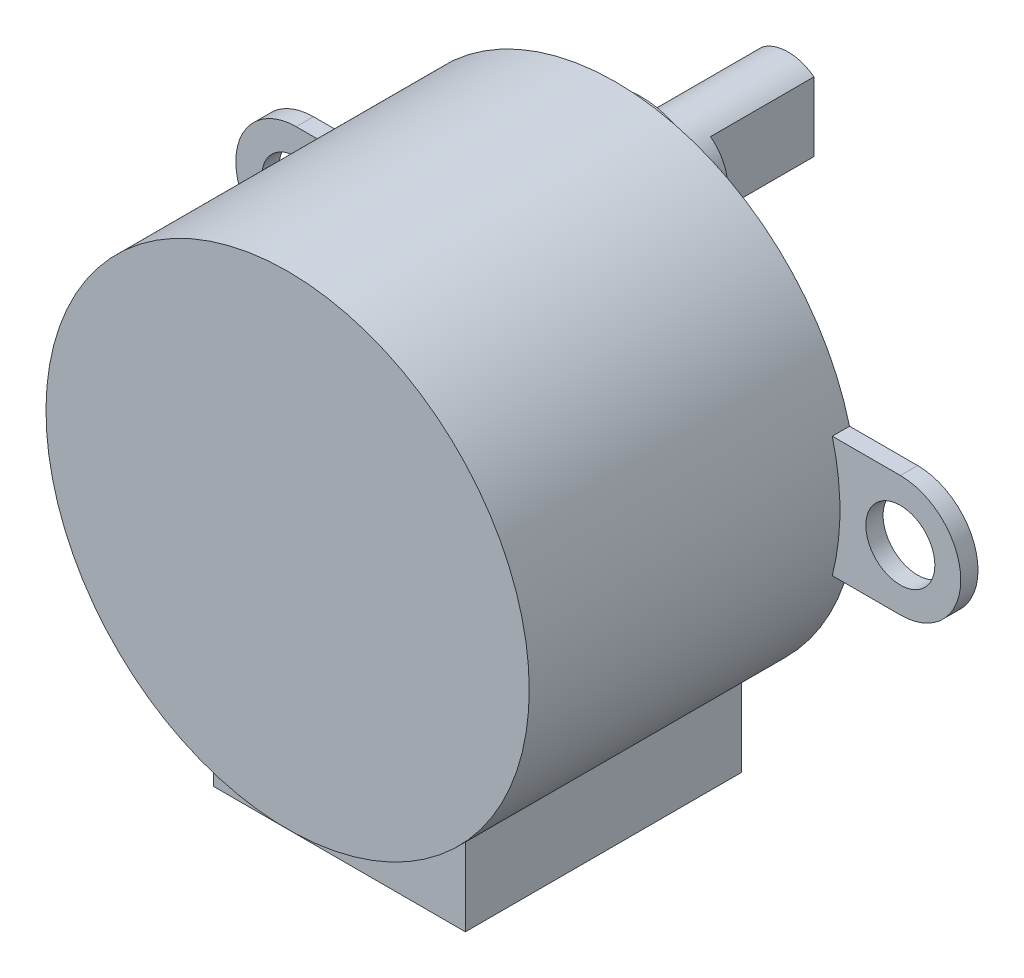
from build123d import *

# Parameters (mm, degrees)
ESQUISSE1_R             = 2
BOSS_EXTRU_1_DEPTH      = 1
ESQUISSE1_3_R           = 14
BOSS_EXTRU_2_DEPTH      = 19
BOSS_EXTRU_3_DEPTH      = 16
ESQUISSE1_5_R           = 4.5
BOSS_EXTRU_4_DEPTH      = 1.5
ESQUISSE1_6_R           = 2.5
BOSS_EXTRU_5_DEPTH      = 10
ESQUISSE2_W             = 1
ESQUISSE2_H             = 5
ENL_V_MAT_EXTRU_1_DEPTH = 6


with BuildPart() as part:
    # Esquisse1 → Boss.-Extru.1 (new body)
    with BuildSketch(Plane.XY):
        with BuildLine():
            Line((-7.3, -11.94612908), (-7.3, -17))
            Line((-7.3, -17), (7.3, -17))
            Line((7.3, -17), (7.3, -11.94612908))
            ThreePointArc((7.3, -11.94612908), (11.250406053, -8.332368429), (13.555441712, -3.5))
            Line((13.555441712, -3.5), (17.5, -3.5))
            ThreePointArc((17.5, -3.5), (21, 0), (17.5, 3.5))
            Line((17.5, 3.5), (13.555441712, 3.5))
            ThreePointArc((13.555441712, 3.5), (0, 14), (-13.555441712, 3.5))
            Line((-13.555441712, 3.5), (-17.5, 3.5))
            ThreePointArc((-17.5, 3.5), (-21, 0), (-17.5, -3.5))
            Line((-17.5, -3.5), (-13.555441712, -3.5))
            ThreePointArc((-13.555441712, -3.5), (-11.250406053, -8.332368429), (-7.3, -11.94612908))
        make_face()
        with Locations((-17.5, 0)):
            Circle(ESQUISSE1_R, mode=Mode.SUBTRACT)
        with Locations((17.5, 0)):
            Circle(ESQUISSE1_R, mode=Mode.SUBTRACT)
    extrude(amount=BOSS_EXTRU_1_DEPTH)

    # Esquisse1<3> → Boss.-Extru.2 (add)
    with BuildSketch(Plane.XY):
        Circle(ESQUISSE1_3_R)
    extrude(amount=BOSS_EXTRU_2_DEPTH)

    # Esquisse1<4> → Boss.-Extru.3 (add)
    with BuildSketch(Plane.XY):
        with BuildLine():
            Line((-7.3, -11.94612908), (-7.3, -17))
            Line((-7.3, -17), (7.3, -17))
            Line((7.3, -17), (7.3, -11.94612908))
            ThreePointArc((7.3, -11.94612908), (0, -14), (-7.3, -11.94612908))
        make_face()
    extrude(amount=BOSS_EXTRU_3_DEPTH)

    # Esquisse1<5> → Boss.-Extru.4 (add)
    with BuildSketch(Plane.XY):
        with Locations((0, 8)):
            Circle(ESQUISSE1_5_R)
    extrude(amount=-BOSS_EXTRU_4_DEPTH)

    # Esquisse1<6> → Boss.-Extru.5 (add)
    with BuildSketch(Plane.XY):
        with Locations((0, 8)):
            Circle(ESQUISSE1_6_R)
    extrude(amount=-BOSS_EXTRU_5_DEPTH)

    # Esquisse2 → Enlèv. mat.-Extru.1 (cut)
    with BuildSketch(Plane(origin=(0, 0, -10), x_dir=(-1, 0, 0), z_dir=(0, 0, -1))):
        with Locations((2, 8)):
            Rectangle(ESQUISSE2_W, ESQUISSE2_H)
        with Locations((-2, 8)):
            Rectangle(ESQUISSE2_W, ESQUISSE2_H)
    extrude(amount=-ENL_V_MAT_EXTRU_1_DEPTH, mode=Mode.SUBTRACT)


solid = part.part
